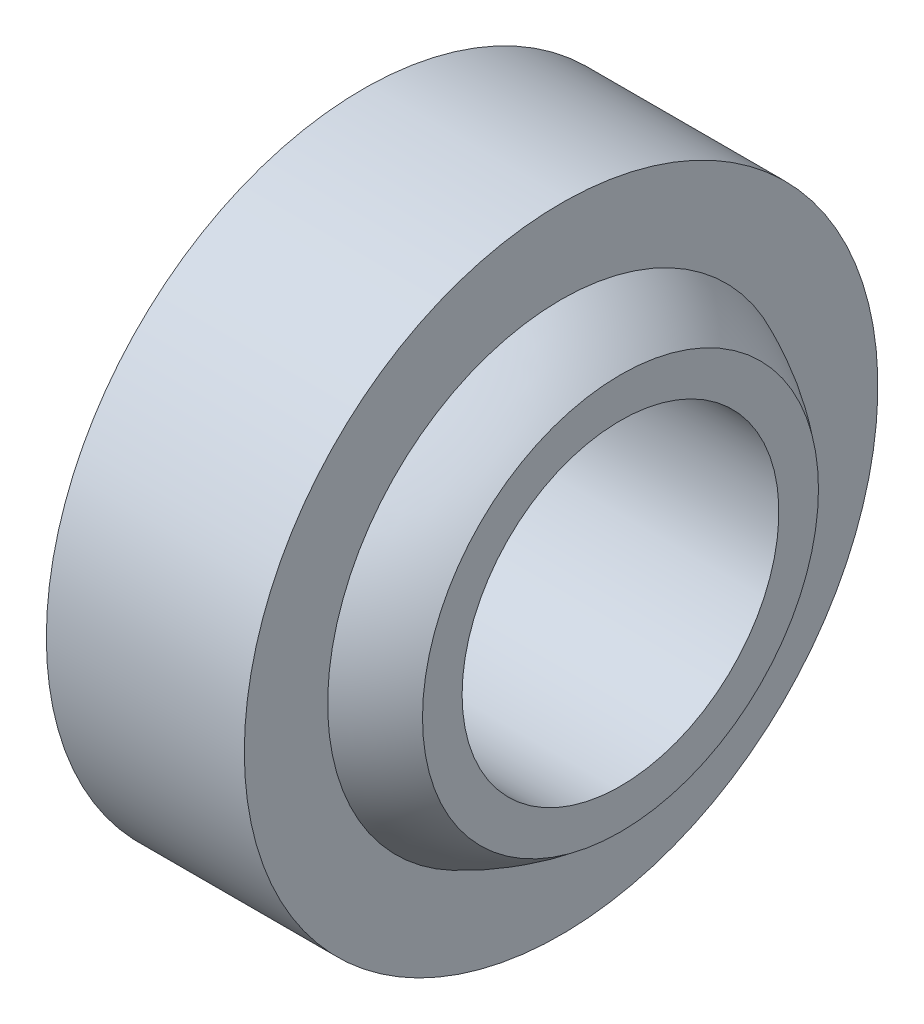
from build123d import *


with BuildPart() as part:
    # 草图1 → 旋转1 (revolve)
    with BuildSketch(Plane.XY):
        with BuildLine():
            Line((4.4431655, 5.894913061), (4.4431655, 8))
            Line((4.4431655, 8), (-0.5568345, 8))
            Line((-0.5568345, 8), (-0.5568345, 5.894913061))
            ThreePointArc((-0.5568345, 5.894913061), (-1.337492566, 5.498843756), (-2.0568345, 5))
            Line((-2.0568345, 5), (-2.0568345, 4))
            Line((-2.0568345, 4), (5.9431655, 4))
            Line((5.9431655, 4), (5.9431655, 5))
            ThreePointArc((5.9431655, 5), (5.223823567, 5.498843756), (4.4431655, 5.894913061))
        make_face()
    revolve(axis=Axis((0, 0, 0), (1, 0, 0)))


solid = part.part
